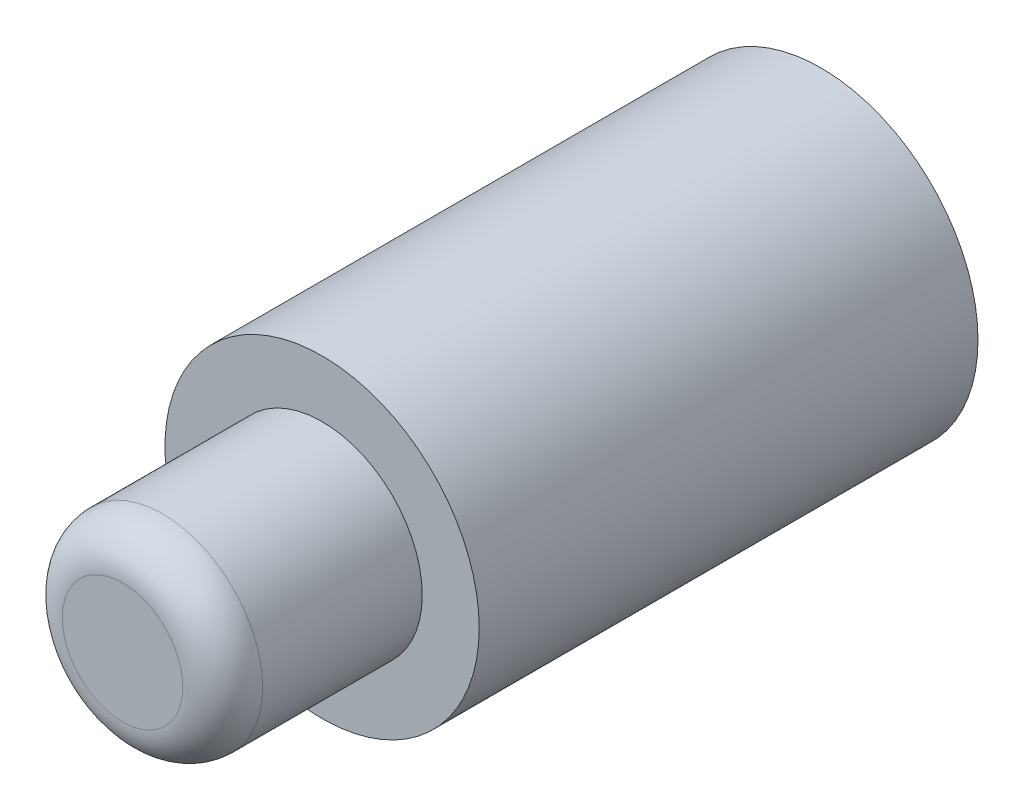
from build123d import *

# Parameters (mm, degrees)
SKETCH1_R           = 2
BOSS_EXTRUDE1_DEPTH = 8.89
CUT_EXTRUDE1_START  = -2.54
SKETCH2_R           = 2
SKETCH2_R_2         = 1.275
CUT_EXTRUDE1_DEPTH  = 2.54
FILLET2_R           = 0.508


with BuildPart() as part:
    # Sketch1 → Boss-Extrude1 (new body)
    with BuildSketch(Plane.XY):
        Circle(SKETCH1_R)
    extrude(amount=BOSS_EXTRUDE1_DEPTH)

    # Sketch2 → Cut-Extrude1 (cut)
    with BuildSketch(Plane.XY.offset(8.89).offset(CUT_EXTRUDE1_START)):
        Circle(SKETCH2_R)
        Circle(SKETCH2_R_2, mode=Mode.SUBTRACT)
    extrude(amount=CUT_EXTRUDE1_DEPTH, mode=Mode.SUBTRACT)

    # Fillet2
    fillet2_edges = [part.edges().sort_by_distance(p)[0] for p in [
        (-1.275, 0, 8.89),
    ]]
    fillet(fillet2_edges, radius=FILLET2_R)


solid = part.part
